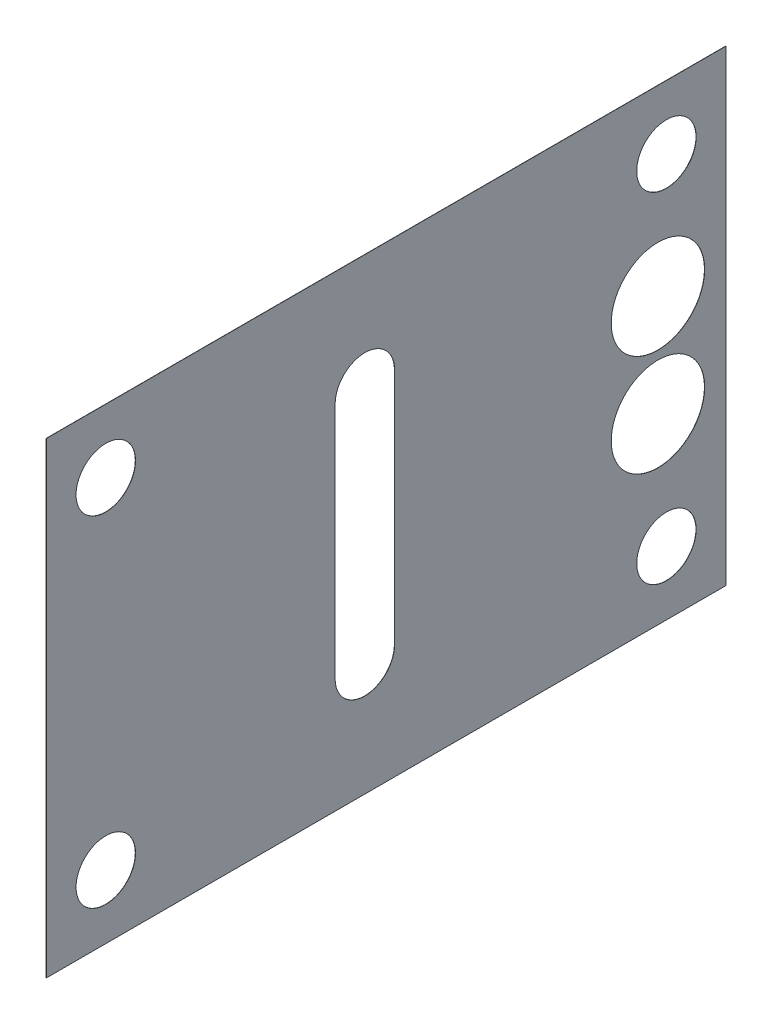
from build123d import *

# Parameters (mm, degrees)
SKETCH1_W             = 160
SKETCH1_H             = 110
BOSS_EXTRUDE1_DEPTH   = 0.0508
M12_CLEARANCE_HOLE1_D = 14
CUT_EXTRUDE1_DEPTH    = 98.082452486
M20_CLEARANCE_HOLE1_D = 22


with BuildPart() as part:
    # Sketch1 → Boss-Extrude1 (new body)
    with BuildSketch(Plane(origin=(0, 0, 0), x_dir=(0, 0, -1), z_dir=(1, 0, 0))):
        Rectangle(SKETCH1_W, SKETCH1_H)
    extrude(amount=BOSS_EXTRUDE1_DEPTH)

    # M12 Clearance Hole1 (through all)
    with Locations(Plane(origin=(0.0508, 0, 0), x_dir=(0, 0, -1), z_dir=(1, 0, 0))):
        with Locations((-66, 40), (66, 40), (66, -40), (-66, -40)):
            Hole(M12_CLEARANCE_HOLE1_D / 2)

    # Sketch4 → Cut-Extrude1 (cut, through all)
    with BuildSketch(Plane(origin=(0.0508, 0, 0), x_dir=(0, 0, -1), z_dir=(1, 0, 0))):
        with BuildLine():
            Line((2, 28), (2, -28))
            ThreePointArc((2, -28), (-5, -35), (-12, -28))
            Line((-12, -28), (-12, 28))
            ThreePointArc((-12, 28), (-5, 35), (2, 28))
        make_face()
    extrude(amount=-CUT_EXTRUDE1_DEPTH, mode=Mode.SUBTRACT)

    # M20 Clearance Hole1 (through all)
    with Locations(Plane(origin=(0.0508, 0, 0), x_dir=(0, 0, -1), z_dir=(1, 0, 0))):
        with Locations((64, 12), (64, -12)):
            Hole(M20_CLEARANCE_HOLE1_D / 2)


solid = part.part
